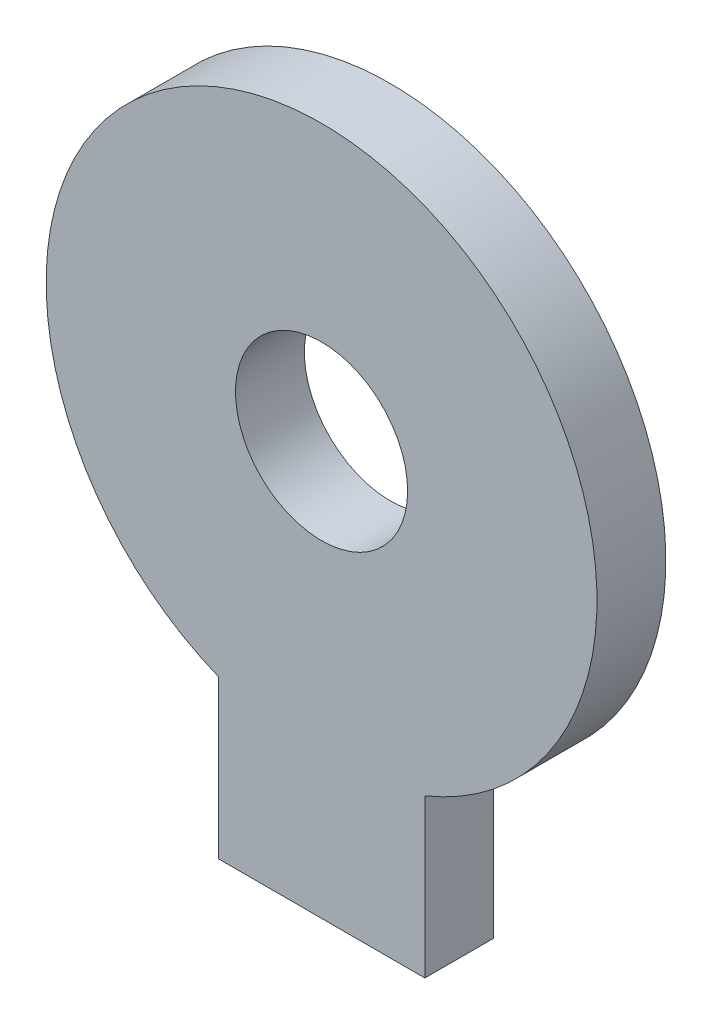
from build123d import *

# Parameters (mm, degrees)
BASE_EXTRUSION_DEPTH    = 2
ESQUISSE2_R             = 2.5
ENL_V_MAT_EXTRU_1_DEPTH = 2


with BuildPart() as part:
    # Esquisse1 → Base-Extrusion (new body)
    with BuildSketch(Plane.XY):
        with BuildLine():
            Line((0, 0), (6, 0))
            Line((6, 0), (6, 4.583801513))
            ThreePointArc((6, 4.583801513), (3, 20), (0, 4.583801513))
            Line((0, 4.583801513), (0, 0))
        make_face()
    extrude(amount=-BASE_EXTRUSION_DEPTH)

    # Esquisse2 → Enlèv. mat.-Extru.1 (cut)
    with BuildSketch(Plane.XY):
        with Locations((3, 12)):
            Circle(ESQUISSE2_R)
    extrude(amount=-ENL_V_MAT_EXTRU_1_DEPTH, mode=Mode.SUBTRACT)


solid = part.part
